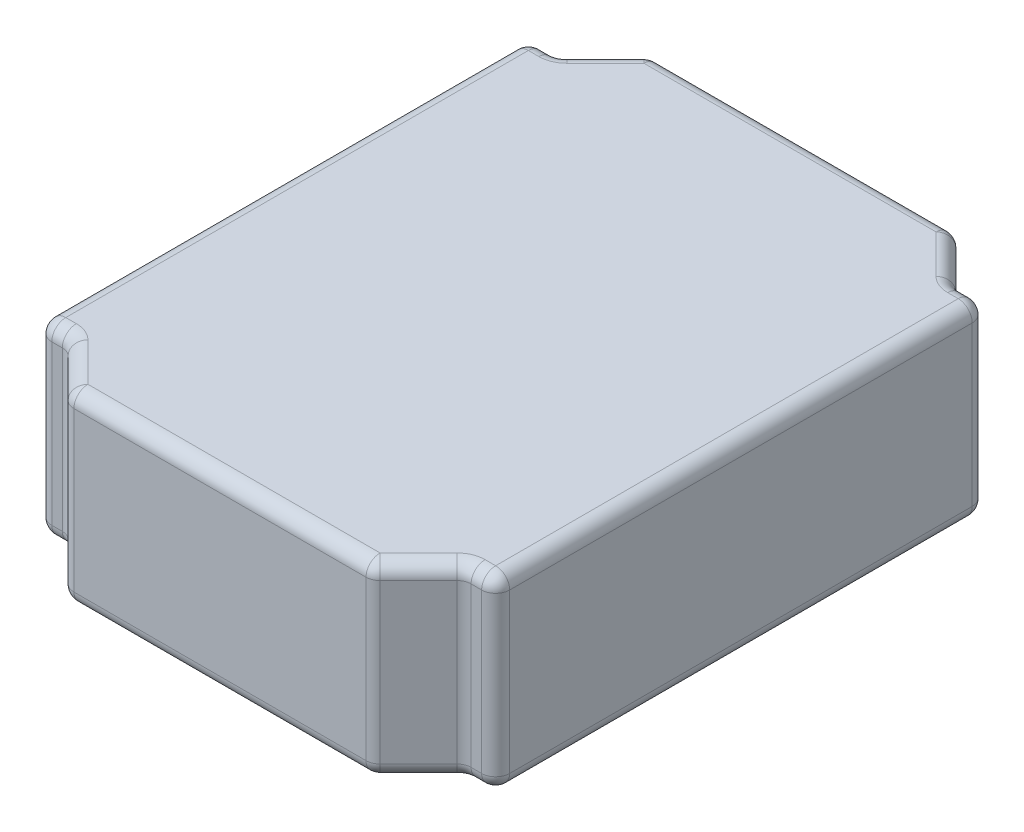
from build123d import *

# Parameters (mm, degrees)
BOSS_EXTRUDE1_DEPTH = 1.016
FILLET1_R           = 0.0762


with BuildPart() as part:
    # Sketch1 → Boss-Extrude1 (new body)
    with BuildSketch(Plane(origin=(0, 0, 0), x_dir=(1, 0, 0), z_dir=(0, 1, 0))):
        Polygon((-1.2446, 1.3335), (-1.0795, 1.3335), (-0.8255, 1.5875), (0.8255, 1.5875), (1.0795, 1.3335), (1.2446, 1.3335), (1.2446, -1.3335), (1.0795, -1.3335), (0.8255, -1.5875), (-0.8255, -1.5875), (-1.0795, -1.3335), (-1.2446, -1.3335), align=None)
    extrude(amount=BOSS_EXTRUDE1_DEPTH)

    # Fillet1
    fillet1_edges = [part.edges().sort_by_distance(p)[0] for p in [
        (0, 1.016, 1.5875),
        (-1.2446, 0, 0),
        (-1.16205, 0, -1.3335),
        (-0.9525, 0, -1.4605),
        (0, 0, -1.5875),
        (0.9525, 0, -1.4605),
        (1.16205, 0, -1.3335),
        (0.9525, 1.016, 1.4605),
        (1.2446, 0, 0),
        (1.16205, 0, 1.3335),
        (0.9525, 0, 1.4605),
        (0, 0, 1.5875),
        (-0.9525, 0, 1.4605),
        (-1.16205, 0, 1.3335),
        (1.16205, 1.016, 1.3335),
        (1.2446, 1.016, 0),
        (-1.2446, 0.508, 1.3335),
        (-1.2446, 0.508, -1.3335),
        (-1.0795, 0.508, -1.3335),
        (-0.8255, 0.508, -1.5875),
        (0.8255, 0.508, -1.5875),
        (1.0795, 0.508, -1.3335),
        (1.2446, 0.508, -1.3335),
        (1.2446, 0.508, 1.3335),
        (1.0795, 0.508, 1.3335),
        (0.8255, 0.508, 1.5875),
        (-0.8255, 0.508, 1.5875),
        (-1.0795, 0.508, 1.3335),
        (1.16205, 1.016, -1.3335),
        (0.9525, 1.016, -1.4605),
        (0, 1.016, -1.5875),
        (-0.9525, 1.016, -1.4605),
        (-1.16205, 1.016, -1.3335),
        (-1.2446, 1.016, 0),
        (-1.16205, 1.016, 1.3335),
        (-0.9525, 1.016, 1.4605),
    ]]
    fillet(fillet1_edges, radius=FILLET1_R)


solid = part.part
